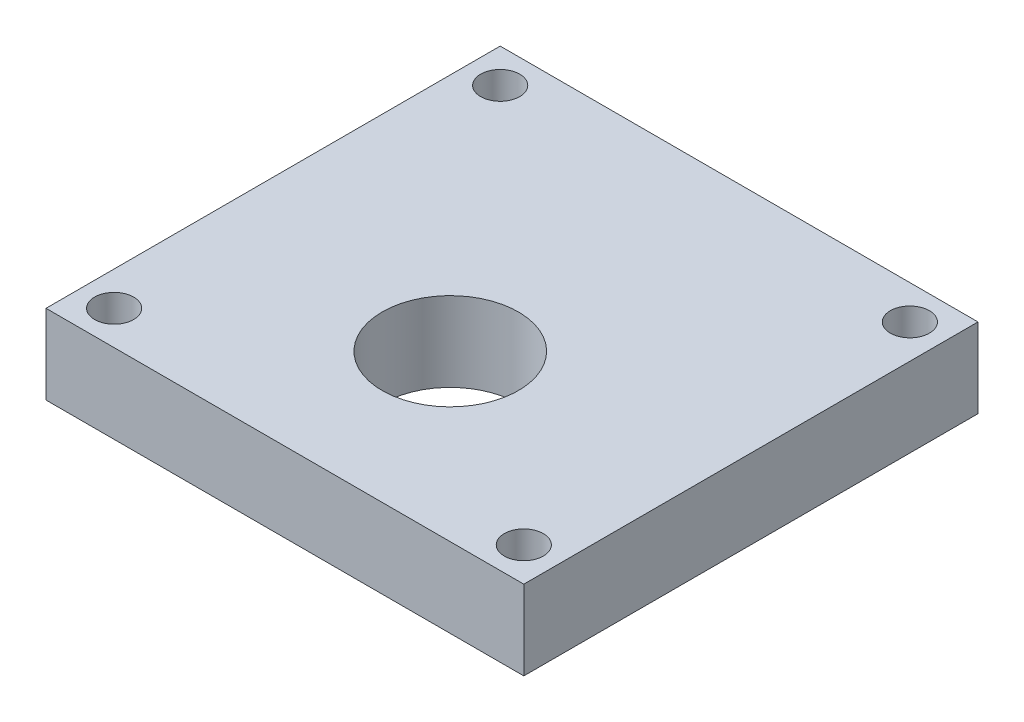
from build123d import *

# Parameters (mm, degrees)
BOSS_EXTRUDE1_DEPTH = 50.8
CUT_EXTRUDE1_REACH  = 70.151
SKETCH2_R           = 7.62
SKETCH3_R           = 2.1828125
CUT_EXTRUDE2_DEPTH  = 69.150694513


with BuildPart() as part:
    # Sketch1 → Boss-Extrude1 (new body)
    with BuildSketch(Plane.XY):
        Polygon((-8.89, 40.64), (-8.89, 46.99), (-8.89, 49.53), (44.5516, 49.53), (44.5516, 46.99), (44.5516, 40.64), align=None)
    extrude(amount=BOSS_EXTRUDE1_DEPTH)

    # Sketch2 → Cut-Extrude1 (cut, up to next)
    with BuildSketch(Plane(origin=(0, 49.53, 0), x_dir=(1, 0, 0), z_dir=(0, 1, 0)), mode=Mode.PRIVATE) as cut_extrude1_sk1:
        with Locations(Location((17.8798, -32.350999872, 0), (0, 0, 180))):
            Circle(SKETCH2_R)
    cut_extrude1_tool1 = extrude(cut_extrude1_sk1.sketch, amount=-CUT_EXTRUDE1_REACH, mode=Mode.PRIVATE) & part.part
    add(cut_extrude1_tool1.solids().sort_by_distance((17.8798, 49.53, 32.351))[0], mode=Mode.SUBTRACT)

    # Sketch3 → Cut-Extrude2 (cut, through all)
    with BuildSketch(Plane(origin=(0, 49.53, 0), x_dir=(1, 0, 0), z_dir=(0, 1, 0))):
        with Locations(Location((40.7416, -46.99, 0), (0, 0, 180))):
            Circle(SKETCH3_R)
        with Locations(Location((-5.08, -46.99, 0), (0, 0, 180))):
            Circle(SKETCH3_R)
        with Locations(Location((-5.08, -3.81, 0), (0, 0, 180))):
            Circle(SKETCH3_R)
        with Locations(Location((40.7416, -3.81, 0), (0, 0, 180))):
            Circle(SKETCH3_R)
    extrude(amount=-CUT_EXTRUDE2_DEPTH, mode=Mode.SUBTRACT)


solid = part.part
